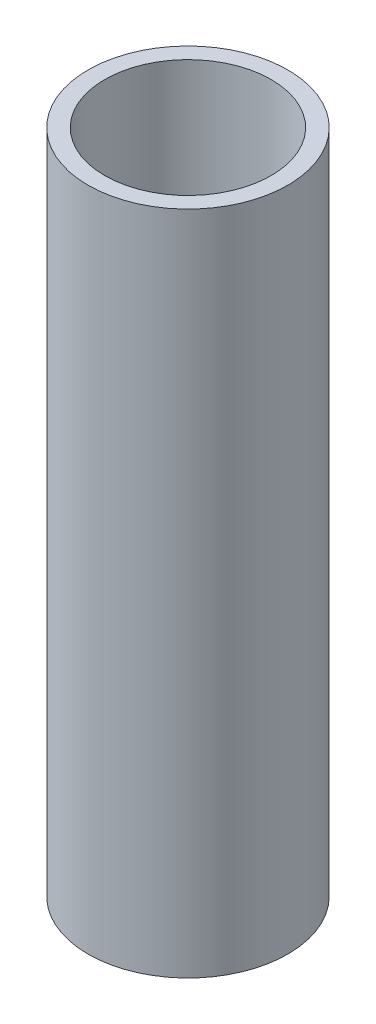
from build123d import *

# Parameters (mm, degrees)
SKETCH1_R           = 15
SKETCH1_R_2         = 12.5
BOSS_EXTRUDE1_DEPTH = 100


with BuildPart() as part:
    # Sketch1 → Boss-Extrude1 (new body)
    with BuildSketch(Plane(origin=(0, 0, 0), x_dir=(1, 0, 0), z_dir=(0, 1, 0))):
        with Locations(Location((0, 0, 0), (0, 0, 270))):
            Circle(SKETCH1_R)
        with Locations(Location((0, 0, 0), (0, 0, 270))):
            Circle(SKETCH1_R_2, mode=Mode.SUBTRACT)
    extrude(amount=BOSS_EXTRUDE1_DEPTH)


solid = part.part
